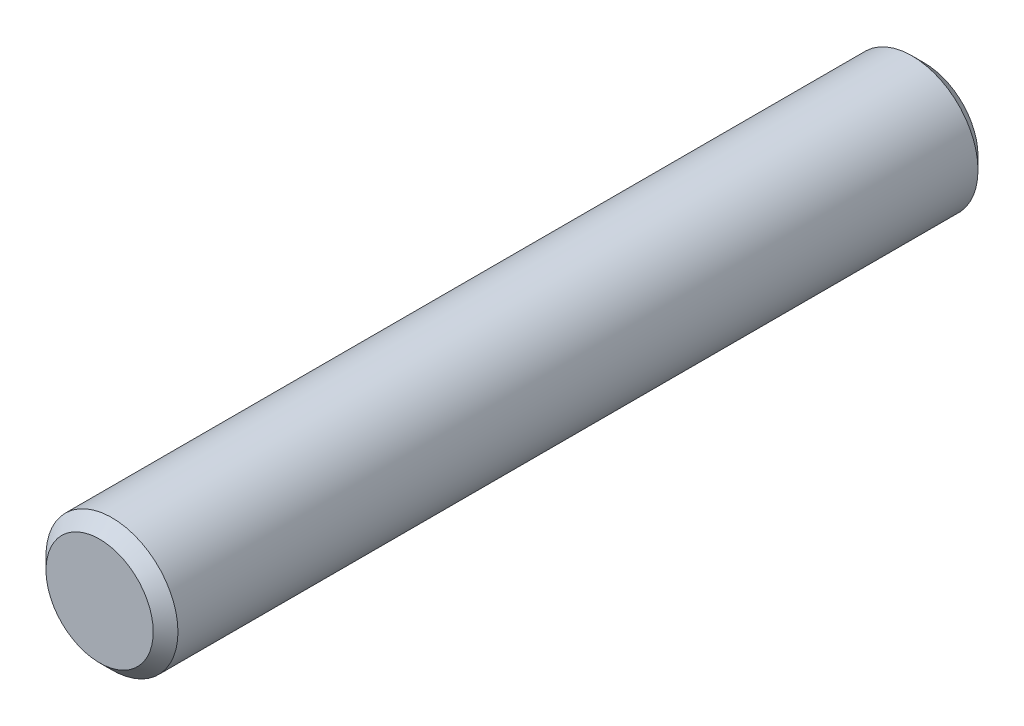
from build123d import *

# Parameters (mm, degrees)
SKETCH1_R           = 4
BOSS_EXTRUDE1_DEPTH = 50
CHAMFER1_SIZE       = 0.75


with BuildPart() as part:
    # Sketch1 → Boss-Extrude1 (new body)
    with BuildSketch(Plane.XY):
        Circle(SKETCH1_R)
    extrude(amount=BOSS_EXTRUDE1_DEPTH)

    # Chamfer1
    chamfer1_edges = [part.edges().sort_by_distance(p)[0] for p in [
        (-4, 0, 0),
        (-4, 0, 50),
    ]]
    chamfer(chamfer1_edges, length=CHAMFER1_SIZE)


solid = part.part
